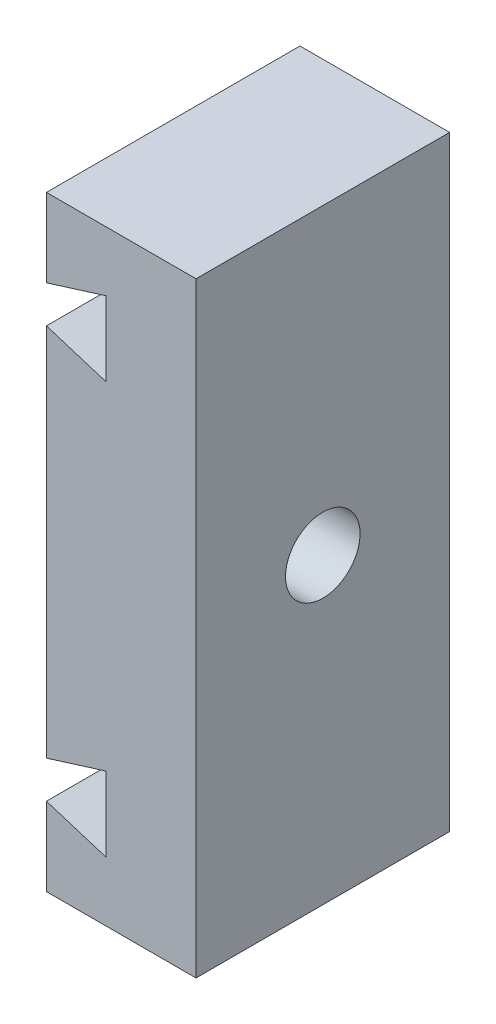
from build123d import *

# Parameters (mm, degrees)
SALIENTE_EXTRUIR1_DEPTH = 8.5
CROQUIS2_R              = 1.25
CORTAR_EXTRUIR1_DEPTH   = 8.5
CROQUIS3_R              = 3
CORTAR_EXTRUIR2_DEPTH   = 2.5


with BuildPart() as part:
    # Croquis1 → Saliente-Extruir1 (new body)
    with BuildSketch(Plane.XY):
        Polygon((12.15, 8.15), (12.15, 5.65), (10.15, 6.275), (10.15, -6.275), (12.15, -5.65), (12.15, -8.15), (10.15, -7.525), (10.15, -10.15), (15.165647838, -10.15), (15.165647838, 10.15), (10.15, 10.15), (10.15, 7.525), align=None)
    extrude(amount=SALIENTE_EXTRUIR1_DEPTH)

    # Croquis2 → Cortar-Extruir1 (cut)
    with BuildSketch(Plane.ZY.offset(-10.15)):
        with Locations((4.25, 0)):
            Circle(CROQUIS2_R)
    extrude(amount=-CORTAR_EXTRUIR1_DEPTH, mode=Mode.SUBTRACT)

    # Croquis3 → Cortar-Extruir2 (cut)
    with BuildSketch(Plane.ZY.offset(-10.15)):
        with Locations((4.25, 0)):
            Circle(CROQUIS3_R)
    extrude(amount=-CORTAR_EXTRUIR2_DEPTH, mode=Mode.SUBTRACT)


solid = part.part
